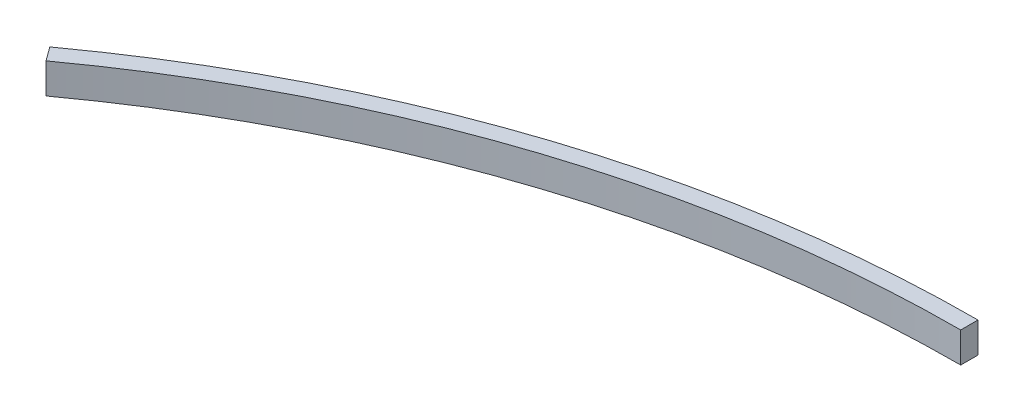
from build123d import *

# Parameters (mm, degrees)
BOSS_EXTRUDE1_DEPTH = 2.794


with BuildPart() as part:
    # Sketch1 → Boss-Extrude1 (new body)
    with BuildSketch(Plane(origin=(0, 0, 0), x_dir=(1, 0, 0), z_dir=(0, 1, 0))):
        with BuildLine():
            Line((-64.384527073, 88.617699021), (-63.451417985, 87.333384543))
            ThreePointArc((-63.451417985, 87.333384543), (-33.358384543, 102.666550934), (0, 107.95))
            Line((0, 107.95), (0, 109.5375))
            ThreePointArc((0, 109.5375), (-33.848949021, 104.176353154), (-64.384527073, 88.617699021))
        make_face()
    extrude(amount=BOSS_EXTRUDE1_DEPTH)


solid = part.part
